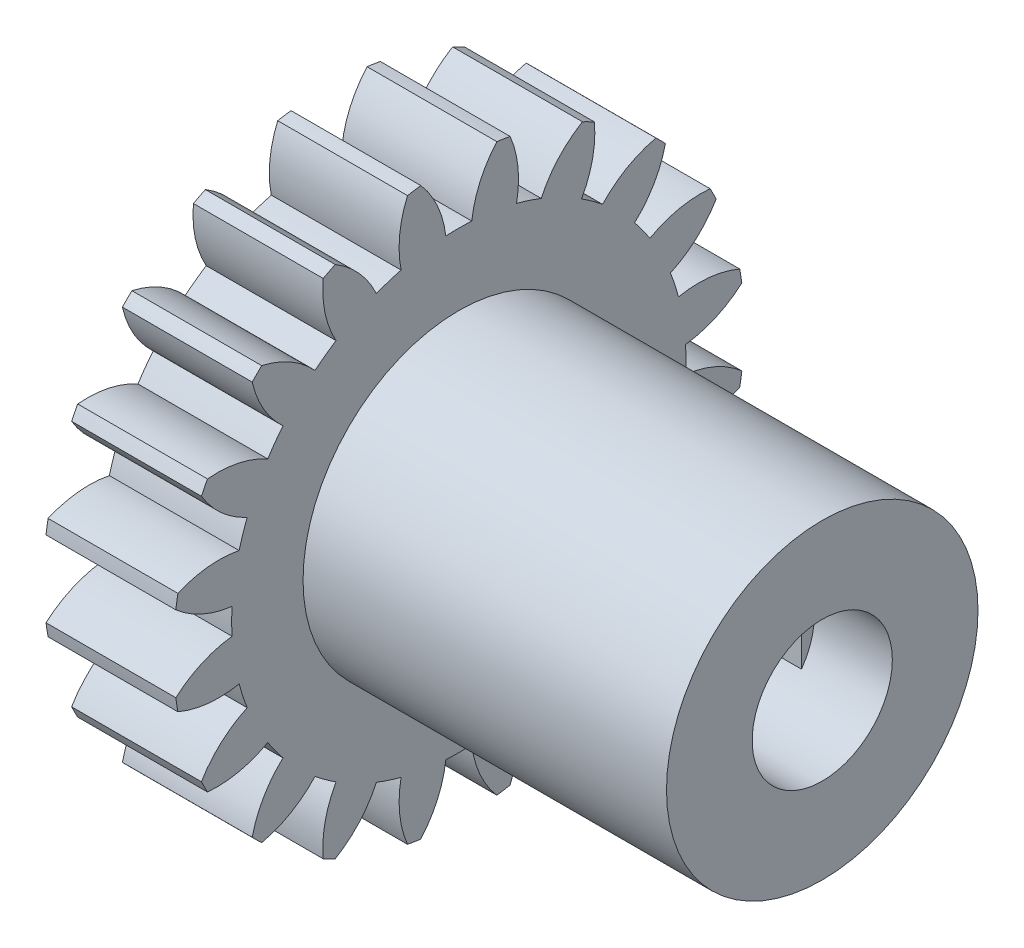
from build123d import *

# Parameters (mm, degrees)
BASPROSKE_W         = 5
BASPROSKE_H         = 11
TOOTHCUT_DEPTH      = 17.340134638
TEETHCUTS_COUNT     = 20
BORSKE_R            = 1.5
BORE_DEPTH          = 50.0000508
SKETCH_1_R          = 6
EXTRUDE_1_DEPTH     = 14
CUT_EXTRUDE_1_DEPTH = 25.468506397
SKETCH_3_R          = 2.7
CUT_EXTRUDE_2_DEPTH = 3


with BuildPart() as part:
    # BasProSke → Base-Revolve (revolve)
    with BuildSketch(Plane(origin=(0, 0, 0), x_dir=(1, 0, 0), z_dir=(0, 1, 0)), mode=Mode.PRIVATE) as base_revolve_sk:
        with Locations((2.5, 5.5)):
            Rectangle(BASPROSKE_W, BASPROSKE_H)
    revolve(base_revolve_sk.sketch.rotate(Axis((-10, 0, 0), (1, 0, 0)), 180), axis=Axis((-10, 0, 0), (1, 0, 0)))

    # TooCutSke → ToothCut (cut, through all)
    with BuildSketch(Plane(origin=(0, 0, 0), x_dir=(0, 0, -1), z_dir=(1, 0, 0))):
        with BuildLine():
            ThreePointArc((0.499924007, 8.734705318), (0, 8.749), (-0.499924007, 8.734705318))
            ThreePointArc((-0.499924007, 8.734705318), (-0.824302243, 9.905497836), (-1.485192705, 10.924909509))
            ThreePointArc((-1.485192705, 10.924909509), (0, 11.0254), (1.485192705, 10.924909509))
            ThreePointArc((1.485192705, 10.924909509), (0.824302243, 9.905497836), (0.499924007, 8.734705318))
        make_face()
    toothcut = extrude(amount=TOOTHCUT_DEPTH, mode=Mode.SUBTRACT)

    # TeethCuts: ToothCut ×20 about axis
    teethcuts_axis = Axis((0, 0, 0), (1, 0, 0))
    for i in range(1, TEETHCUTS_COUNT):
        add(toothcut.rotate(teethcuts_axis, i * 360 / TEETHCUTS_COUNT), mode=Mode.SUBTRACT)

    # BorSke → Bore (cut, symmetric)
    with BuildSketch(Plane(origin=(0, 0, 0), x_dir=(0, 0, -1), z_dir=(1, 0, 0))):
        with Locations(Location((0, 0, 0), (0, 0, 180))):
            Circle(BORSKE_R)
    extrude(amount=BORE_DEPTH, both=True, mode=Mode.SUBTRACT)

    # 草图1 → 凸台-拉伸1 (add)
    with BuildSketch(Plane(origin=(5, 0, 0), x_dir=(0, 0, -1), z_dir=(1, 0, 0))):
        with Locations(Location((0, 0, 0), (0, 0, 180))):
            Circle(SKETCH_1_R)
    extrude(amount=EXTRUDE_1_DEPTH)

    # 草图2 → 切除-拉伸1 (cut, through all)
    with BuildSketch(Plane(origin=(19, 0, 0), x_dir=(0, 0, -1), z_dir=(1, 0, 0))):
        with BuildLine():
            Line((2.2, 1.565247584), (2.2, -1.565247584))
            ThreePointArc((2.2, -1.565247584), (-2.7, 0), (2.2, 1.565247584))
        make_face()
    extrude(amount=-CUT_EXTRUDE_1_DEPTH, mode=Mode.SUBTRACT)

    # 草图3 → 切除-拉伸2 (cut)
    with BuildSketch(Plane(origin=(19, 0, 0), x_dir=(0, 0, -1), z_dir=(1, 0, 0))):
        Circle(SKETCH_3_R)
    extrude(amount=-CUT_EXTRUDE_2_DEPTH, mode=Mode.SUBTRACT)


solid = part.part
